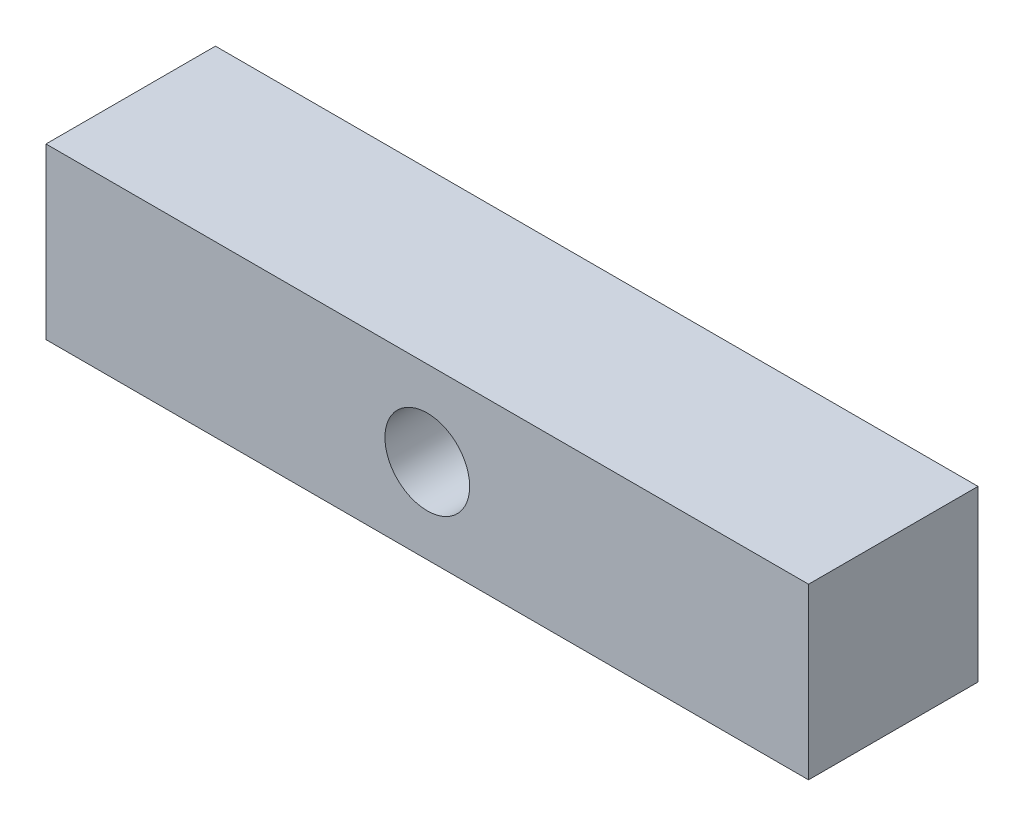
from build123d import *

# Parameters (mm, degrees)
SKETCH1_W           = 114.3
SKETCH1_H           = 25.4
BOSS_EXTRUDE1_DEPTH = 25.4
SKETCH2_R           = 6.35
CUT_EXTRUDE1_DEPTH  = 120.811560377


with BuildPart() as part:
    # Sketch1 → Boss-Extrude1 (new body)
    with BuildSketch(Plane.XY):
        with Locations((57.15, 12.7)):
            Rectangle(SKETCH1_W, SKETCH1_H)
    extrude(amount=BOSS_EXTRUDE1_DEPTH)

    # Sketch2 → Cut-Extrude1 (cut, through all)
    with BuildSketch(Plane.XY.offset(25.4)):
        with Locations((57.15, 12.7)):
            Circle(SKETCH2_R)
    extrude(amount=-CUT_EXTRUDE1_DEPTH, mode=Mode.SUBTRACT)


solid = part.part
